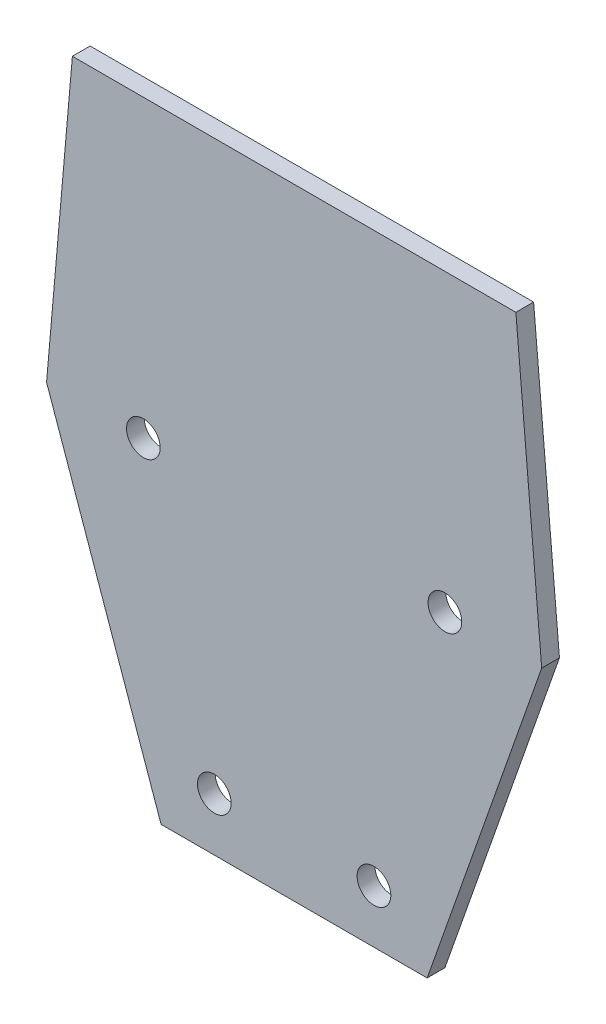
from build123d import *

# Parameters (mm, degrees)
BOSS_EXTRUDE1_DEPTH = 2.54
SKETCH3_R           = 2.413
CUT_EXTRUDE1_DEPTH  = 70.828376229


with BuildPart() as part:
    # Sketch1 → Boss-Extrude1 (new body)
    with BuildSketch(Plane.XY):
        Polygon((-31.75, 28.792017296), (31.75, 28.792017296), (35.44828546, -13.479578937), (19.05, -60.107982704), (-19.05, -60.107982704), (-35.44828546, -13.479578937), align=None)
    extrude(amount=BOSS_EXTRUDE1_DEPTH)

    # Sketch3 → Cut-Extrude1 (cut, through all)
    with BuildSketch(Plane(origin=(0, 0, 0), x_dir=(-1, 0, 0), z_dir=(0, 0, -1))):
        with Locations((11.43, -52.487982704)):
            Circle(SKETCH3_R)
        with Locations((-11.43, -52.487982704)):
            Circle(SKETCH3_R)
        with Locations((21.59, -13.479578937)):
            Circle(SKETCH3_R)
        with Locations((-21.59, -13.479578937)):
            Circle(SKETCH3_R)
    extrude(amount=-CUT_EXTRUDE1_DEPTH, mode=Mode.SUBTRACT)


solid = part.part
